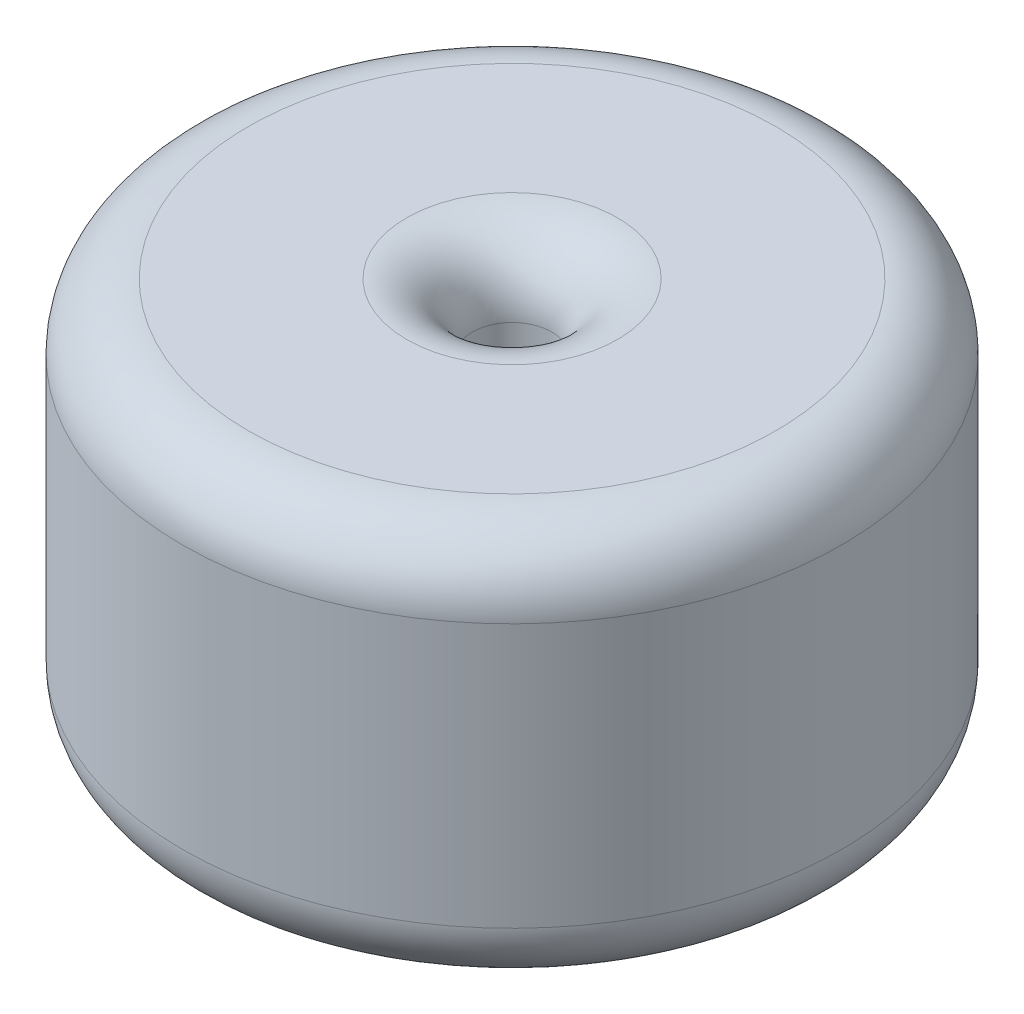
from build123d import *

# Parameters (mm, degrees)
SKETCH_1_R      = 25
SKETCH_1_R_2    = 3
EXTRUDE_1_DEPTH = 30
FILLET_1_R      = 5
FILLET_2_R      = 5


with BuildPart() as part:
    # 草圖1 → 伸長1 (new body)
    with BuildSketch(Plane(origin=(0, 0, 0), x_dir=(1, 0, 0), z_dir=(0, 1, 0))):
        with Locations(Location((0, 0, 0), (0, 0, 270))):
            Circle(SKETCH_1_R)
        with Locations(Location((0, 0, 0), (0, 0, 270))):
            Circle(SKETCH_1_R_2, mode=Mode.SUBTRACT)
    extrude(amount=EXTRUDE_1_DEPTH)

    # 圓角1
    fillet_1_edges = [part.edges().sort_by_distance(p)[0] for p in [
        (0, 30, -25),
        (0, 0, -3),
        (0, 30, -3),
    ]]
    fillet(fillet_1_edges, radius=FILLET_1_R)

    # 圓角2
    fillet_2_edges = [part.edges().sort_by_distance(p)[0] for p in [
        (0, 0, -25),
    ]]
    fillet(fillet_2_edges, radius=FILLET_2_R)


solid = part.part
